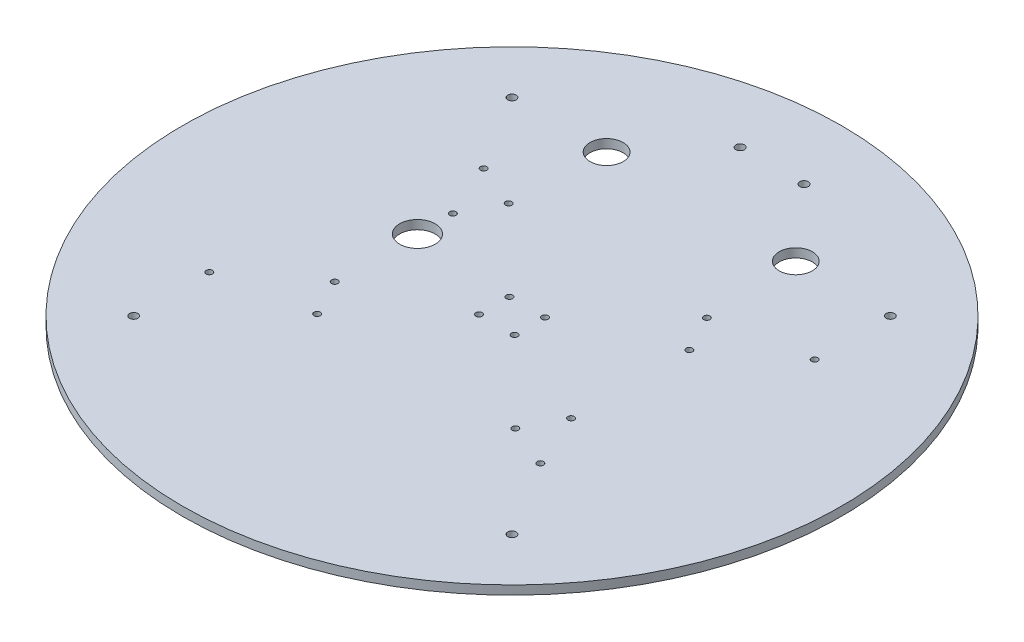
from build123d import *

# Parameters (mm, degrees)
SKETCH1_R            = 177
SKETCH1_R_2          = 2.2479
BOSS_EXTRUDE1_DEPTH  = 4.7625
SKETCH2_R            = 1.7
JETSONHOLES_DEPTH    = 251.361102023
SKETCH3_R            = 9.525
UART_WIRE_HOLE_DEPTH = 4.7625
SKETCH4_R            = 2.286
CAMERA_HOLE_DEPTH    = 4.7625
SKETCH5_R            = 1.7
STANDOFFHOLES_DEPTH  = 251.361102023
SKETCH6_R            = 1.7
SKETCH6_R_2          = 8.89
NIMH_HOLES_DEPTH     = 251.361102023
SKETCH7_R            = 1.7
IMU_HOLES_DEPTH      = 251.361102023


with BuildPart() as part:
    # Sketch1 → Boss-Extrude1 (new body)
    with BuildSketch(Plane(origin=(0, 0, 0), x_dir=(1, 0, 0), z_dir=(0, 1, 0))):
        with Locations(Location((0, 0, 0), (0, 0, 90))):
            Circle(SKETCH1_R)
        with Locations(Location((-101.6, -101.6, 0), (0, 0, 90))):
            Circle(SKETCH1_R_2, mode=Mode.SUBTRACT)
        with Locations(Location((-101.6, 101.6, 0), (0, 0, 90))):
            Circle(SKETCH1_R_2, mode=Mode.SUBTRACT)
        with Locations(Location((101.6, 101.6, 0), (0, 0, 90))):
            Circle(SKETCH1_R_2, mode=Mode.SUBTRACT)
        with Locations(Location((101.6, -101.6, 0), (0, 0, 90))):
            Circle(SKETCH1_R_2, mode=Mode.SUBTRACT)
    extrude(amount=BOSS_EXTRUDE1_DEPTH)

    # Sketch2 → JetsonHoles (cut, through all)
    with BuildSketch(Plane(origin=(0, 4.7625, 0), x_dir=(1, 0, 0), z_dir=(0, 1, 0))):
        with Locations(Location((-53.213, 51.435, 0), (0, 0, 270))):
            Circle(SKETCH2_R)
        with Locations(Location((53.213, 51.435, 0), (0, 0, 270))):
            Circle(SKETCH2_R)
        with Locations(Location((-53.213, -51.435, 0), (0, 0, 270))):
            Circle(SKETCH2_R)
        with Locations(Location((53.213, -51.435, 0), (0, 0, 270))):
            Circle(SKETCH2_R)
    extrude(amount=-JETSONHOLES_DEPTH, mode=Mode.SUBTRACT)

    # Sketch3 → UART-Wire-Hole (cut)
    with BuildSketch(Plane(origin=(0, 4.7625, 0), x_dir=(1, 0, 0), z_dir=(0, 1, 0))):
        with Locations(Location((-63.5, 12.7, 0), (0, 0, 270))):
            Circle(SKETCH3_R)
    extrude(amount=-UART_WIRE_HOLE_DEPTH, mode=Mode.SUBTRACT)

    # Sketch4 → Camera-Hole (cut)
    with BuildSketch(Plane(origin=(0, 4.7625, 0), x_dir=(1, 0, 0), z_dir=(0, 1, 0))):
        with Locations(Location((-17.145, 139.7, 0), (0, 0, 270))):
            Circle(SKETCH4_R)
        with Locations(Location((17.145, 139.7, 0), (0, 0, 270))):
            Circle(SKETCH4_R)
    extrude(amount=-CAMERA_HOLE_DEPTH, mode=Mode.SUBTRACT)

    # Sketch5 → StandoffHoles (cut, through all)
    with BuildSketch(Plane(origin=(0, 4.7625, 0), x_dir=(1, 0, 0), z_dir=(0, 1, 0))):
        with Locations(Location((-63.5, -31.75, 0), (0, 0, 270))):
            Circle(SKETCH5_R)
        with Locations(Location((63.5, -31.75, 0), (0, 0, 270))):
            Circle(SKETCH5_R)
        with Locations(Location((63.5, 31.75, 0), (0, 0, 270))):
            Circle(SKETCH5_R)
        with Locations(Location((-63.5, 31.75, 0), (0, 0, 270))):
            Circle(SKETCH5_R)
    extrude(amount=-STANDOFFHOLES_DEPTH, mode=Mode.SUBTRACT)

    # Sketch6 → NiMH_Holes (cut, through all)
    with BuildSketch(Plane(origin=(0, 4.7625, 0), x_dir=(1, 0, 0), z_dir=(0, 1, 0))):
        with Locations(Location((101.6, 60.96, 0), (0, 0, 270))):
            Circle(SKETCH6_R)
        with Locations(Location((76.2, -60.96, 0), (0, 0, 270))):
            Circle(SKETCH6_R)
        with Locations(Location((-101.6, -60.96, 0), (0, 0, 270))):
            Circle(SKETCH6_R)
        with Locations(Location((-76.2, 60.96, 0), (0, 0, 270))):
            Circle(SKETCH6_R)
        with Locations(Location((-50.8, 101.6, 0), (0, 0, 270))):
            Circle(SKETCH6_R_2)
        with Locations(Location((50.8, 101.6, 0), (0, 0, 270))):
            Circle(SKETCH6_R_2)
    extrude(amount=-NIMH_HOLES_DEPTH, mode=Mode.SUBTRACT)

    # Sketch7 → IMU_Holes (cut, through all)
    with BuildSketch(Plane(origin=(0, 4.7625, 0), x_dir=(1, 0, 0), z_dir=(0, 1, 0))):
        with Locations(Location((-9.55000005, 8.162499942, 0), (0, 0, 270))):
            Circle(SKETCH7_R)
        with Locations(Location((9.54999995, 8.162499942, 0), (0, 0, 270))):
            Circle(SKETCH7_R)
        with Locations(Location((-9.55000005, -8.162500058, 0), (0, 0, 270))):
            Circle(SKETCH7_R)
        with Locations(Location((9.54999995, -8.162500058, 0), (0, 0, 270))):
            Circle(SKETCH7_R)
    extrude(amount=-IMU_HOLES_DEPTH, mode=Mode.SUBTRACT)


solid = part.part
